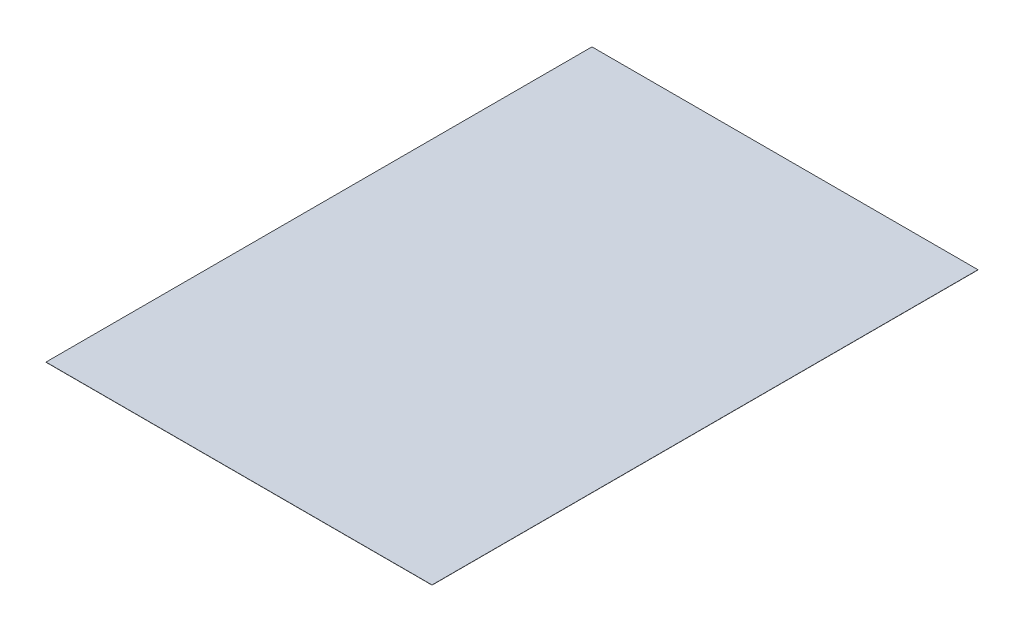
from build123d import *

# Parameters (mm, degrees)
ESQUISSE1_W        = 210
ESQUISSE1_H        = 297
BOSS_EXTRU_1_DEPTH = 0.1


with BuildPart() as part:
    # Esquisse1 → Boss.-Extru.1 (new body)
    with BuildSketch(Plane(origin=(0, 0, 0), x_dir=(1, 0, 0), z_dir=(0, 1, 0))):
        with Locations((105, 148.5)):
            Rectangle(ESQUISSE1_W, ESQUISSE1_H)
    extrude(amount=BOSS_EXTRU_1_DEPTH)


solid = part.part
